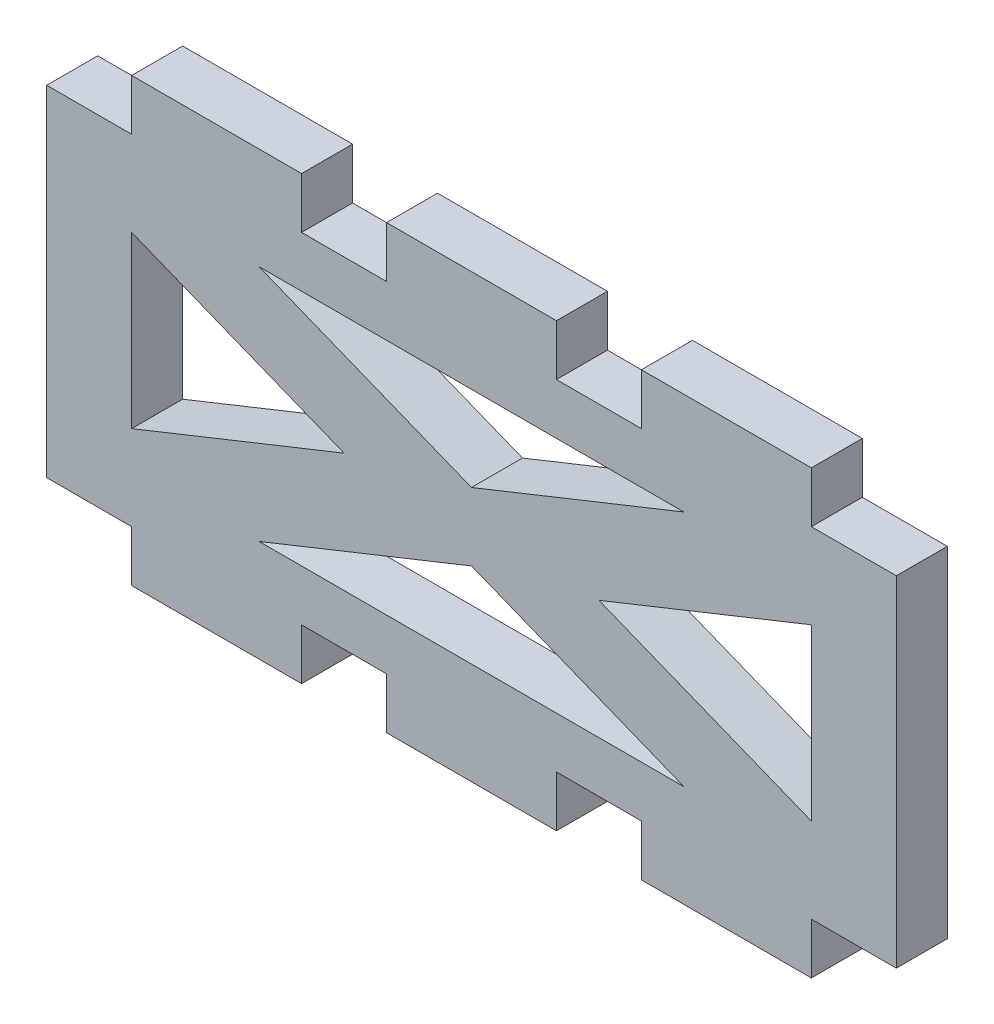
from build123d import *

# Parameters (mm, degrees)
EXTRUDE_1_DEPTH = 3


with BuildPart() as part:
    # 草图1 → 凸台-拉伸1 (new body)
    with BuildSketch(Plane.XY):
        Polygon((-25, -10), (-20, -10), (-20, -13), (-10, -13), (-10, -10), (-5, -10), (-5, -13), (5, -13), (5, -10), (10, -10), (10, -13), (20, -13), (20, -10), (25, -10), (25, -8), (25, -2), (25, 2), (25, 8), (25, 10), (20, 10), (20, 13), (10, 13), (10, 10), (5, 10), (5, 13), (-5, 13), (-5, 10), (-10, 10), (-10, 13), (-20, 13), (-20, 10), (-25, 10), (-25, 8), (-25, 2), (-25, -2), (-25, -8), align=None)
        Polygon((-12.5, 7), (12.5, 7), (0, 2), align=None, mode=Mode.SUBTRACT)
        Polygon((20, -5), (20, 5), (7.5, 0), align=None, mode=Mode.SUBTRACT)
        Polygon((-12.5, -7), (12.5, -7), (0, -2), align=None, mode=Mode.SUBTRACT)
        Polygon((-20, -5), (-7.5, 0), (-20, 5), align=None, mode=Mode.SUBTRACT)
    extrude(amount=EXTRUDE_1_DEPTH)


solid = part.part
